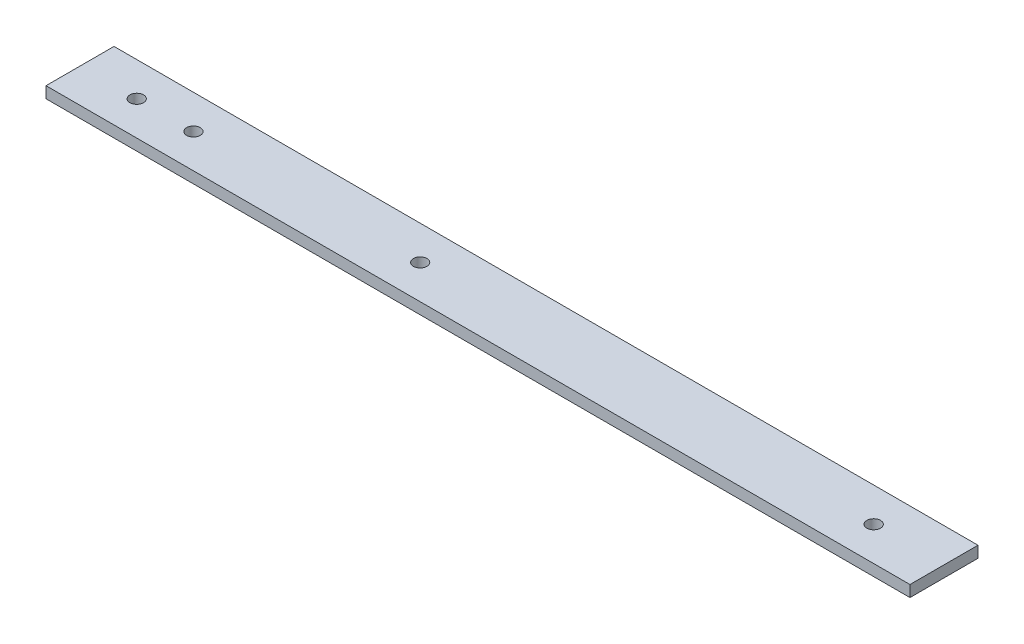
from build123d import *

# Parameters (mm, degrees)
SKETCH1_W           = 381
SKETCH1_H           = 30
SKETCH1_R           = 3
BOSS_EXTRUDE1_DEPTH = 5


with BuildPart() as part:
    # Sketch1 → Boss-Extrude1 (new body)
    with BuildSketch(Plane(origin=(0, 0, 0), x_dir=(1, 0, 0), z_dir=(0, 1, 0))):
        with Locations((190.5, 15)):
            Rectangle(SKETCH1_W, SKETCH1_H)
        with Locations(Location((25, 15, 0), (0, 0, 270))):
            Circle(SKETCH1_R, mode=Mode.SUBTRACT)
        with Locations(Location((50, 15, 0), (0, 0, 270))):
            Circle(SKETCH1_R, mode=Mode.SUBTRACT)
        with Locations(Location((150, 15, 0), (0, 0, 270))):
            Circle(SKETCH1_R, mode=Mode.SUBTRACT)
        with Locations(Location((350, 15, 0), (0, 0, 270))):
            Circle(SKETCH1_R, mode=Mode.SUBTRACT)
    extrude(amount=BOSS_EXTRUDE1_DEPTH)


solid = part.part
